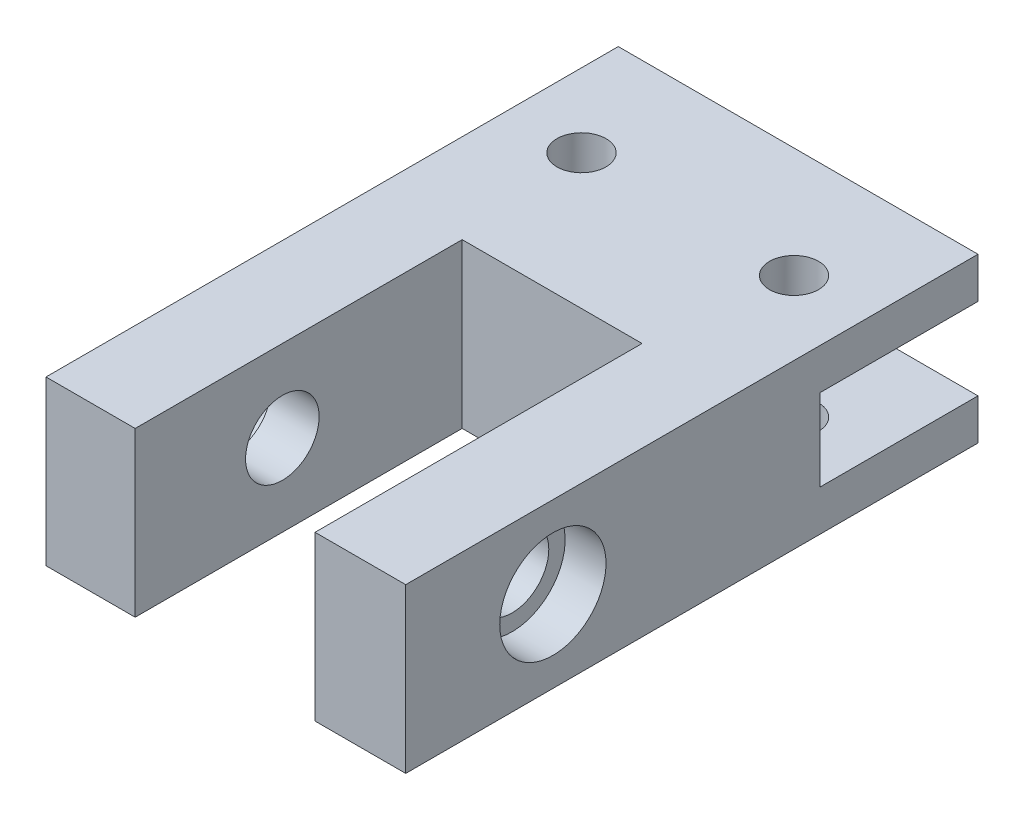
from build123d import *

# Parameters (mm, degrees)
SKETCH_1_W               = 44
SKETCH_1_H               = 20
EXTRUDE_1_DEPTH          = 70
SKETCH_2_W               = 22
SKETCH_2_H               = 20
CUT_EXTRUDE_1_DEPTH      = 40
SKETCH_3_R               = 4.5
CUT_EXTRUDE_2_DEPTH      = 50
SKETCH_4_R               = 6.5
CUT_EXTRUDE_4_DEPTH      = 5
SKETCH_5_R               = 3
CUT_EXTRUDE_5_DEPTH      = 29
CUT_EXTRUDE_6_DEPTH      = 5
CUT_EXTRUDE_6_DEPTH_BACK = 5


with BuildPart() as part:
    # 스케치1 → 보스-돌출1 (new body)
    with BuildSketch(Plane.XY):
        Rectangle(SKETCH_1_W, SKETCH_1_H)
    extrude(amount=EXTRUDE_1_DEPTH)

    # 스케치2 → 컷-돌출1 (cut)
    with BuildSketch(Plane.XY.offset(70)):
        with Locations((-0.092136373, 0)):
            Rectangle(SKETCH_2_W, SKETCH_2_H)
    extrude(amount=-CUT_EXTRUDE_1_DEPTH, mode=Mode.SUBTRACT)

    # 스케치3 → 컷-돌출2 (cut)
    with BuildSketch(Plane(origin=(22, 0, 0), x_dir=(0, 0, -1), z_dir=(1, 0, 0))):
        with Locations((-52, 0)):
            Circle(SKETCH_3_R)
    extrude(amount=-CUT_EXTRUDE_2_DEPTH, mode=Mode.SUBTRACT)

    # 스케치4 → 컷-돌출4 (cut)
    with BuildSketch(Plane.ZY.offset(-22)):
        with Locations((52, 0)):
            Circle(SKETCH_4_R)
    cut_extrude_4 = extrude(amount=CUT_EXTRUDE_4_DEPTH, mode=Mode.SUBTRACT)

    # 스케치5 → 컷-돌출5 (cut)
    with BuildSketch(Plane(origin=(0, 10, 0), x_dir=(1, 0, 0), z_dir=(0, 1, 0))):
        with Locations((13, -13.5)):
            Circle(SKETCH_5_R)
    cut_extrude_5 = extrude(amount=-CUT_EXTRUDE_5_DEPTH, mode=Mode.SUBTRACT)

    # 대칭 복사2: 컷-돌출4, 컷-돌출5 across plane
    add(cut_extrude_4.mirror(Plane(origin=(0, 0, 0), x_dir=(0, 0, 1), z_dir=(1, 0, 0))), mode=Mode.SUBTRACT)
    add(cut_extrude_5.mirror(Plane(origin=(0, 0, 0), x_dir=(0, 0, 1), z_dir=(1, 0, 0))), mode=Mode.SUBTRACT)

    # 스케치6 → 컷-돌출6 (cut, two sides: drawn at the far end of the back side and taken through both)
    with BuildSketch(Plane(origin=(0, 0, 0), x_dir=(1, 0, 0), z_dir=(0, 1, 0)).offset(-CUT_EXTRUDE_6_DEPTH_BACK)):
        Polygon((2.5, -24), (2.5, 0), (22, 0), (22, -19.349242405), (17.349242405, -24), align=None)
        Polygon((-22, -19.349242405), (-22, 0), (-2.5, 0), (-2.5, -24), (-17.349242405, -24), align=None)
    extrude(amount=CUT_EXTRUDE_6_DEPTH + CUT_EXTRUDE_6_DEPTH_BACK, mode=Mode.SUBTRACT)


solid = part.part
